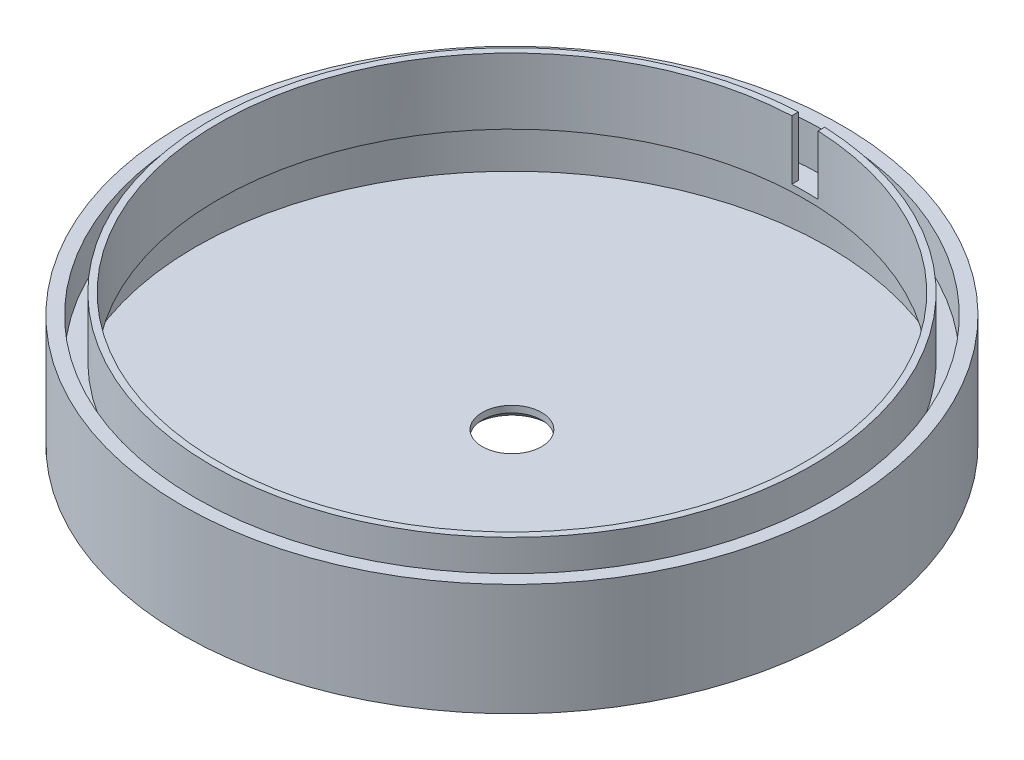
from build123d import *

# Parameters (mm, degrees)
ESQUISSE1_R             = 50
BOSS_EXTRU_1_DEPTH      = 17
COQUE1_T                = -2
ESQUISSE2_R             = 4.5
ENL_V_MAT_EXTRU_3_DEPTH = 73.725511342
CHANFREIN1_SIZE         = 1
ESQUISSE3_R             = 50
ESQUISSE3_R_2           = 44.5
BOSS_EXTRU_2_DEPTH      = 1
ESQUISSE4_R             = 45.5
ESQUISSE4_R_2           = 44.5
BOSS_EXTRU_3_DEPTH      = 10
ESQUISSE5_W             = 4
ESQUISSE5_H             = 2.5
ENL_V_MAT_EXTRU_4_DEPTH = 9


with BuildPart() as part:
    # Esquisse1 → Boss.-Extru.1 (new body)
    with BuildSketch(Plane(origin=(0, 0, 0), x_dir=(1, 0, 0), z_dir=(0, 1, 0))):
        with Locations(Location((0, 0, 0), (0, 0, 270))):
            Circle(ESQUISSE1_R)
    extrude(amount=BOSS_EXTRU_1_DEPTH)

    # Coque1
    coque1_openings = [part.faces().sort_by_distance(p)[0] for p in [
        (0, 17, 0),
    ]]
    offset(amount=COQUE1_T, openings=coque1_openings, kind=Kind.INTERSECTION)

    # Esquisse2 → Enlèv. mat.-Extru.3 (cut, through all)
    with BuildSketch(Plane(origin=(0, 0, 0), x_dir=(1, 0, 0), z_dir=(0, 1, 0))):
        with Locations(Location((0, 0, 0), (0, 0, 270))):
            Circle(ESQUISSE2_R)
    extrude(amount=ENL_V_MAT_EXTRU_3_DEPTH, mode=Mode.SUBTRACT)

    # Chanfrein1
    chanfrein1_edges = [part.edges().sort_by_distance(p)[0] for p in [
        (0, 0, -4.5),
    ]]
    chamfer(chanfrein1_edges, length=CHANFREIN1_SIZE)

    # Esquisse3 → Boss.-Extru.2 (add)
    with BuildSketch(Plane(origin=(0, 10, 0), x_dir=(1, 0, 0), z_dir=(0, 1, 0))):
        with Locations(Location((0, 0, 0), (0, 0, 270))):
            Circle(ESQUISSE3_R)
        with Locations(Location((0, 0, 0), (0, 0, 270))):
            Circle(ESQUISSE3_R_2, mode=Mode.SUBTRACT)
    extrude(amount=BOSS_EXTRU_2_DEPTH)

    # Esquisse4 → Boss.-Extru.3 (add)
    with BuildSketch(Plane(origin=(0, 10, 0), x_dir=(1, 0, 0), z_dir=(0, 1, 0))):
        with Locations(Location((0, 0, 0), (0, 0, 270))):
            Circle(ESQUISSE4_R)
        with Locations(Location((0, 0, 0), (0, 0, 270))):
            Circle(ESQUISSE4_R_2, mode=Mode.SUBTRACT)
    extrude(amount=BOSS_EXTRU_3_DEPTH)

    # Esquisse5 → Enlèv. mat.-Extru.4 (cut)
    with BuildSketch(Plane(origin=(0, 20, 0), x_dir=(1, 0, 0), z_dir=(0, 1, 0))):
        with Locations((0, 45.25)):
            Rectangle(ESQUISSE5_W, ESQUISSE5_H)
    extrude(amount=-ENL_V_MAT_EXTRU_4_DEPTH, mode=Mode.SUBTRACT)


solid = part.part
